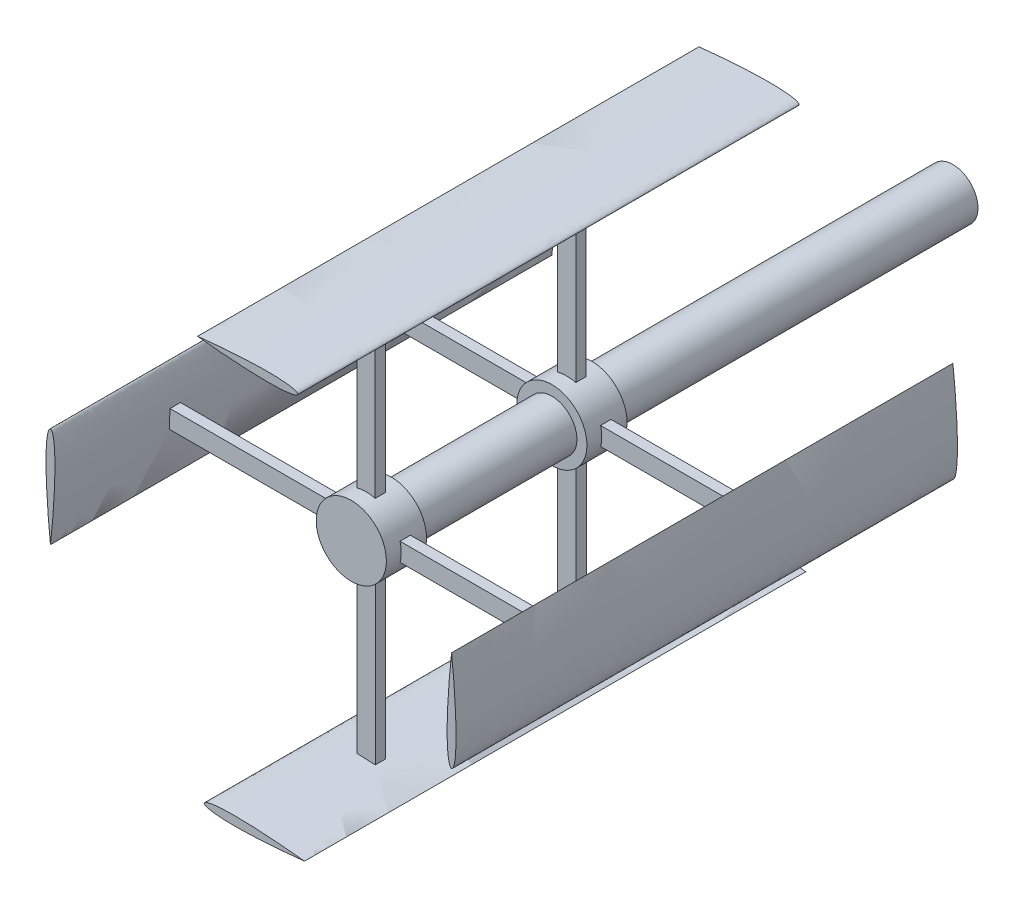
from build123d import *

# Parameters (mm, degrees)
BOSS_EXTRUDE1_DEPTH             = 4000
BOSS_EXTRUDE1_DEPTH_BACK        = 2000
SKETCH5_R                       = 250
CIRPATTERN1_COUNT               = 4
SKETCH6_R                       = 350
SKETCH6_R_2                     = 250
BOSS_EXTRUDE2_DEPTH             = 400
BOSS_EXTRUDE4_REACH             = 6372.468
SKETCH9_W                       = 181.972350928
SKETCH9_H                       = 104.34903776
BOSS_EXTRUDE4_DIRECTION_2_DEPTH = 343
CIRPATTERN3_COUNT               = 4
SKETCH10_W                      = 181.972350928
SKETCH10_H                      = 104.34903776
BOSS_EXTRUDE5_DEPTH             = 620.224003
SKETCH11_W                      = 104.34903776
SKETCH11_H                      = 181.972350927
BOSS_EXTRUDE6_DEPTH             = 620.224003
SKETCH13_W                      = 181.972350928
SKETCH13_H                      = 104.34903776
BOSS_EXTRUDE7_DEPTH             = 620.224003
BOSS_EXTRUDE8_REACH             = 7271.263
SKETCH14_W                      = 104.34903776
SKETCH14_H                      = 181.972350927
LPATTERN1_COUNT                 = 2
LPATTERN1_PITCH                 = 2000
LPATTERN1_COPY_1_REACH          = 6372.468
LPATTERN1_COPY_1_SKETCH_W       = 181.972350928
LPATTERN1_COPY_1_SKETCH_H       = 104.34903776
LPATTERN1_COPY_2_REACH          = 6372.468
LPATTERN1_COPY_2_SKETCH_W       = 181.972350928
LPATTERN1_COPY_2_SKETCH_H       = 104.34903776
LPATTERN1_COPY_3_REACH          = 6372.468
LPATTERN1_COPY_3_SKETCH_W       = 181.972350928
LPATTERN1_COPY_3_SKETCH_H       = 104.34903776
LPATTERN1_COPY_4_SKETCH_W       = 181.972350928
LPATTERN1_COPY_4_SKETCH_H       = 104.34903776
LPATTERN1_COPY_4_DEPTH          = 343
LPATTERN1_COPY_5_SKETCH_W       = 181.972350928
LPATTERN1_COPY_5_SKETCH_H       = 104.34903776
LPATTERN1_COPY_5_DEPTH          = 343
LPATTERN1_COPY_6_SKETCH_W       = 181.972350928
LPATTERN1_COPY_6_SKETCH_H       = 104.34903776
LPATTERN1_COPY_6_DEPTH          = 343
LPATTERN1_COPY_7_SKETCH_W       = 181.972350928
LPATTERN1_COPY_7_SKETCH_H       = 104.34903776
LPATTERN1_COPY_7_DEPTH          = 343


with BuildPart() as part:
    # Sweep1: sweep along a path in Sketch3
    with BuildLine(Plane(origin=(0, 0, 0), x_dir=(1, 0, 0), z_dir=(0, 1, 0))) as sweep1_path:
        Line((500, 0), (500, -5000))
    # Sketch4 → Sweep1 (sweep)
    with BuildSketch(Plane.XY):
        with BuildLine():
            add(Edge.make_bspline(
                [(1000, 0), (1000, 0.191040895), (990.865245222, 0.951125249), (981.49660914, 2.537213531), (958.739512049, 4.968815703), (930.779177553, 7.987124194), (894.347051677, 11.529083604), (851.573731345, 15.437867754), (802.646360468, 19.63799535), (748.588774622, 24.006561796), (690.262831773, 28.369072327), (628.68553307, 32.596262938), (564.906050312, 36.493619421), (500.016433896, 39.896095237), (435.124638768, 42.601431609), (381.543260627, 44.164259279), (339.511718948, 44.882211336), (308.933871531, 45.137009208), (279.172080095, 45.101417057), (250.35363758, 44.718302967), (222.604194241, 44.045810482), (196.044872168, 43.030201218), (170.787295132, 41.708455855), (146.936278956, 40.049763322), (124.59295766, 38.082190127), (103.860229761, 35.788508909), (84.824513182, 33.212446526), (67.560238467, 30.4204119), (52.139306362, 27.424910473), (38.611812384, 24.236323385), (27.041817277, 20.747268542), (17.454434039, 16.893121794), (9.937386289, 12.640601185), (4.531711913, 8.200031179), (1.155830595, 4.130072447), (-0.472965693, 0), (1.155830595, -4.130072447), (4.531711913, -8.200031179), (9.937386289, -12.640601185), (17.454434039, -16.893121794), (27.041817277, -20.747268542), (38.611812384, -24.236323385), (52.139306362, -27.424910473), (67.560238467, -30.4204119), (84.824513182, -33.212446526), (103.860229761, -35.788508909), (124.59295766, -38.082190127), (146.936278956, -40.049763322), (170.787295132, -41.708455855), (196.044872168, -43.030201218), (222.604194241, -44.045810482), (250.35363758, -44.718302967), (279.172080095, -45.101417057), (308.933871531, -45.137009208), (339.511718948, -44.882211336), (381.543260627, -44.164259279), (435.124638768, -42.601431609), (500.016433896, -39.896095237), (564.906050312, -36.493619421), (628.68553307, -32.596262938), (690.262831773, -28.369072327), (748.588774622, -24.006561796), (802.646360468, -19.63799535), (851.573731345, -15.437867754), (894.347051677, -11.529083604), (930.779177553, -7.987124194), (958.739512049, -4.968815703), (981.49660914, -2.537213531), (990.865245222, -0.951125249), (1000, -0.191040895), (1000, 0)],
                knots=[0, 0, 0, 0, 0.002133427, 0.008488156, 0.018944487, 0.033319114, 0.051356294, 0.072756093, 0.097140817, 0.124097489, 0.153162557, 0.183833918, 0.215589374, 0.247878195, 0.280150868, 0.311860397, 0.327332943, 0.342462846, 0.357187102, 0.371448118, 0.385183441, 0.398331273, 0.410844637, 0.422672607, 0.433769314, 0.444090175, 0.453589412, 0.46224044, 0.470010037, 0.476870985, 0.482833353, 0.487908551, 0.492155164, 0.495592273, 0.498196359, 0.5, 0.501803641, 0.504407727, 0.507844836, 0.512091449, 0.517166647, 0.523129015, 0.529989963, 0.53775956, 0.546410588, 0.555909825, 0.566230686, 0.577327393, 0.589155363, 0.601668727, 0.614816559, 0.628551882, 0.642812898, 0.657537154, 0.672667057, 0.688139603, 0.719849132, 0.752121805, 0.784410626, 0.816166082, 0.846837443, 0.875902511, 0.902859183, 0.927243907, 0.948643706, 0.966680886, 0.981055513, 0.991511844, 0.997866573, 1, 1, 1, 1], degree=3))
        make_face()
    sweep(path=sweep1_path.line)


with BuildPart() as body_2:
    # Sketch5 → Boss-Extrude1 (new, two sides: drawn at the far end of the back side and taken through both)
    with BuildSketch(Plane.XY.offset(-BOSS_EXTRUDE1_DEPTH_BACK)):
        with Locations((466.896664005, 2000)):
            Circle(SKETCH5_R)
    extrude(amount=BOSS_EXTRUDE1_DEPTH + BOSS_EXTRUDE1_DEPTH_BACK)

    # Sketch6 → Boss-Extrude2 (add)
    with BuildSketch(Plane.XY.offset(4000)):
        with Locations((466.896664005, 2000)):
            Circle(SKETCH6_R)
        with Locations((466.896664005, 2000)):
            Circle(SKETCH6_R_2, mode=Mode.SUBTRACT)
    boss_extrude2 = extrude(amount=-BOSS_EXTRUDE2_DEPTH)

    # Sketch9 → Boss-Extrude4 (add, up to next)
    with BuildSketch(Plane(origin=(0, 3000, 0), x_dir=(1, 0, 0), z_dir=(0, 1, 0)), mode=Mode.PRIVATE) as boss_extrude4_sk1:
        with Locations((466.549346026, -3800)):
            Rectangle(SKETCH9_W, SKETCH9_H)
    boss_extrude4_tool1 = extrude(boss_extrude4_sk1.sketch, amount=-BOSS_EXTRUDE4_REACH, mode=Mode.PRIVATE) - body_2.part
    boss_extrude4 = boss_extrude4_tool1.solids().sort_by_distance((466.549346, 3000, 3800))[0]
    add(boss_extrude4)

    # Sketch9 → Boss-Extrude4 direction 2 (add)
    with BuildSketch(Plane(origin=(0, 3000, 0), x_dir=(1, 0, 0), z_dir=(0, 1, 0))):
        with Locations((466.549346026, -3800)):
            Rectangle(SKETCH9_W, SKETCH9_H)
    boss_extrude4_direction_2 = extrude(amount=BOSS_EXTRUDE4_DIRECTION_2_DEPTH)

    # CirPattern3: Boss-Extrude4, Boss-Extrude4 direction 2 ×4 about axis
    cirpattern3_axis = Axis((466.896664005, 2000, 0), (0, 0, 1))
    add([boss_extrude4.rotate(cirpattern3_axis, i * 360 / CIRPATTERN3_COUNT) for i in range(1, CIRPATTERN3_COUNT)])
    add([boss_extrude4_direction_2.rotate(cirpattern3_axis, i * 360 / CIRPATTERN3_COUNT) for i in range(1, CIRPATTERN3_COUNT)])



with BuildPart() as cirpattern1_1:
    # CirPattern1: pattern copy
    add(part.part.rotate(Axis((466.896664005, 2000, -2000), (0, 0, 1)), 1 * 360 / CIRPATTERN1_COUNT))

    # Sketch14 → Boss-Extrude8 (add, up to next)
    with BuildSketch(Plane(origin=(1809.896664005, 0, 0), x_dir=(0, 0, -1), z_dir=(1, 0, 0)), mode=Mode.PRIVATE) as boss_extrude8_sk1:
        with Locations((-3800, 2000.347317979)):
            Rectangle(SKETCH14_W, SKETCH14_H)
    boss_extrude8_tool1 = extrude(boss_extrude8_sk1.sketch, amount=BOSS_EXTRUDE8_REACH, mode=Mode.PRIVATE) - cirpattern1_1.part
    boss_extrude8 = boss_extrude8_tool1.solids().sort_by_distance((1809.896664, 2000.347318, 3800))[0]
    add(boss_extrude8)


with BuildPart() as cirpattern1_2:
    # CirPattern1: pattern copy
    add(part.part.rotate(Axis((466.896664005, 2000, -2000), (0, 0, 1)), 2 * 360 / CIRPATTERN1_COUNT))


with BuildPart() as cirpattern1_3:
    # CirPattern1: pattern copy
    add(part.part.rotate(Axis((466.896664005, 2000, -2000), (0, 0, 1)), 3 * 360 / CIRPATTERN1_COUNT))


with BuildPart() as body_2_1:
    add(body_2.part)

    add(cirpattern1_2.part)  # Boss-Extrude5 merges CirPattern1_2
    # Sketch10 → Boss-Extrude5 (add)
    with BuildSketch(Plane(origin=(0, 3343, 0), x_dir=(1, 0, 0), z_dir=(0, 1, 0))):
        with Locations((466.549346026, -3800)):
            Rectangle(SKETCH10_W, SKETCH10_H)
    boss_extrude5 = extrude(amount=BOSS_EXTRUDE5_DEPTH)


    add(cirpattern1_3.part)  # Boss-Extrude6 merges CirPattern1_3
    # Sketch11 → Boss-Extrude6 (add)
    with BuildSketch(Plane.ZY.offset(876.103335995)):
        with Locations((3800, 1999.652682022)):
            Rectangle(SKETCH11_W, SKETCH11_H)
    boss_extrude6 = extrude(amount=BOSS_EXTRUDE6_DEPTH)


with BuildPart() as part_1:
    add(part.part)

    add(body_2_1.part)  # Boss-Extrude7 merges body 2
    # Sketch13 → Boss-Extrude7 (add)
    with BuildSketch(Plane.XZ.offset(-657)):
        with Locations((467.243981983, 3800)):
            Rectangle(SKETCH13_W, SKETCH13_H)
    boss_extrude7 = extrude(amount=BOSS_EXTRUDE7_DEPTH)

    add(cirpattern1_1.part)  # LPattern1 merges CirPattern1_1
    # LPattern1: Boss-Extrude2, Boss-Extrude4, Boss-Extrude4 direction 2, Boss-Extrude5, Boss-Extrude6, Boss-Extrude7, Boss-Extrude8 ×2
    with Locations(*[(0, 0, -i * LPATTERN1_PITCH) for i in range(1, LPATTERN1_COUNT)]):
        add(boss_extrude2)
        add(boss_extrude4)
        add(boss_extrude4_direction_2)
        add(boss_extrude5)
        add(boss_extrude6)
        add(boss_extrude7)
        add(boss_extrude8)

    # LPattern1 copy 1 sketch → LPattern1 copy 1 (add, up to next)
    with BuildSketch(Plane(origin=(-533.103335995, 1533.103335995, -2000), x_dir=(0, 1, 0), z_dir=(-1, 0, 0)), mode=Mode.PRIVATE) as lpattern1_copy_1_sk1:
        with Locations((466.549346026, -3800)):
            Rectangle(LPATTERN1_COPY_1_SKETCH_W, LPATTERN1_COPY_1_SKETCH_H)
    lpattern1_copy_1_tool1 = extrude(lpattern1_copy_1_sk1.sketch, amount=-LPATTERN1_COPY_1_REACH, mode=Mode.PRIVATE) - part_1.part
    add(lpattern1_copy_1_tool1.solids().sort_by_distance((-533.103335995, 1999.652681995, 1800))[0])

    # LPattern1 copy 2 sketch → LPattern1 copy 2 (add, up to next)
    with BuildSketch(Plane(origin=(933.79332801, 1000, -2000), x_dir=(-1, 0, 0), z_dir=(0, -1, 0)), mode=Mode.PRIVATE) as lpattern1_copy_2_sk1:
        with Locations((466.549346026, -3800)):
            Rectangle(LPATTERN1_COPY_2_SKETCH_W, LPATTERN1_COPY_2_SKETCH_H)
    lpattern1_copy_2_tool1 = extrude(lpattern1_copy_2_sk1.sketch, amount=-LPATTERN1_COPY_2_REACH, mode=Mode.PRIVATE) - part_1.part
    add(lpattern1_copy_2_tool1.solids().sort_by_distance((467.24398201, 1000, 1800))[0])

    # LPattern1 copy 3 sketch → LPattern1 copy 3 (add, up to next)
    with BuildSketch(Plane(origin=(1466.896664005, 2466.896664005, -2000), x_dir=(0, -1, 0), z_dir=(1, 0, 0)), mode=Mode.PRIVATE) as lpattern1_copy_3_sk1:
        with Locations((466.549346026, -3800)):
            Rectangle(LPATTERN1_COPY_3_SKETCH_W, LPATTERN1_COPY_3_SKETCH_H)
    lpattern1_copy_3_tool1 = extrude(lpattern1_copy_3_sk1.sketch, amount=-LPATTERN1_COPY_3_REACH, mode=Mode.PRIVATE) - part_1.part
    add(lpattern1_copy_3_tool1.solids().sort_by_distance((1466.896664005, 2000.347318005, 1800))[0])

    # LPattern1 copy 4 sketch → LPattern1 copy 4 (add)
    with BuildSketch(Plane(origin=(-533.103335995, 1533.103335995, -2000), x_dir=(0, 1, 0), z_dir=(-1, 0, 0))):
        with Locations((466.549346026, -3800)):
            Rectangle(LPATTERN1_COPY_4_SKETCH_W, LPATTERN1_COPY_4_SKETCH_H)
    extrude(amount=LPATTERN1_COPY_4_DEPTH)

    # LPattern1 copy 5 sketch → LPattern1 copy 5 (add)
    with BuildSketch(Plane(origin=(933.79332801, 1000, -2000), x_dir=(-1, 0, 0), z_dir=(0, -1, 0))):
        with Locations((466.549346026, -3800)):
            Rectangle(LPATTERN1_COPY_5_SKETCH_W, LPATTERN1_COPY_5_SKETCH_H)
    extrude(amount=LPATTERN1_COPY_5_DEPTH)

    # LPattern1 copy 6 sketch → LPattern1 copy 6 (add)
    with BuildSketch(Plane(origin=(1466.896664005, 2466.896664005, -2000), x_dir=(0, -1, 0), z_dir=(1, 0, 0))):
        with Locations((466.549346026, -3800)):
            Rectangle(LPATTERN1_COPY_6_SKETCH_W, LPATTERN1_COPY_6_SKETCH_H)
    extrude(amount=LPATTERN1_COPY_6_DEPTH)

    # LPattern1 copy 7 sketch → LPattern1 copy 7 (add)
    with BuildSketch(Plane(origin=(0, 3000, -2000), x_dir=(1, 0, 0), z_dir=(0, 1, 0))):
        with Locations((466.549346026, -3800)):
            Rectangle(LPATTERN1_COPY_7_SKETCH_W, LPATTERN1_COPY_7_SKETCH_H)
    extrude(amount=LPATTERN1_COPY_7_DEPTH)


solid = part_1.part
